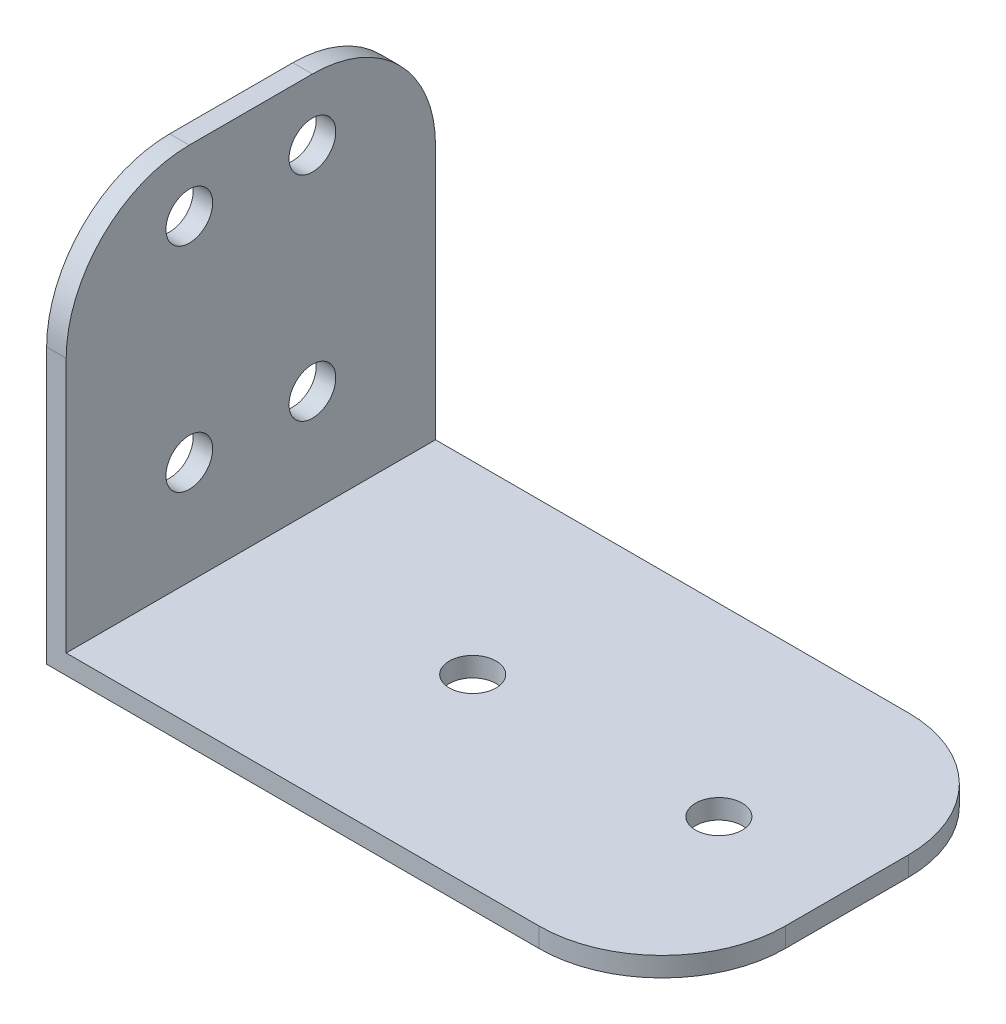
from build123d import *

# Parameters (mm, degrees)
BOSS_EXTRUDE1_DEPTH   = 15
F_6_CLEARANCE_HOLE1_D = 3.7973
FILLET1_R             = 10
F_6_CLEARANCE_HOLE2_D = 3.7973


with BuildPart() as part:
    # Sketch2 → Boss-Extrude1 (new, symmetric)
    with BuildSketch(Plane.XY):
        Polygon((0, 0), (50, 0), (50, 1.5875), (1.5875, 1.5875), (1.5875, 32.32), (0, 32.32), align=None)
    extrude(amount=BOSS_EXTRUDE1_DEPTH, both=True)

    # #6 Clearance Hole1 (through all)
    with Locations(Plane.ZY):
        with Locations((-5, 27.32), (5, 10), (5, 27.32), (-5, 10)):
            Hole(F_6_CLEARANCE_HOLE1_D / 2)

    # Fillet1
    fillet1_edges = [part.edges().sort_by_distance(p)[0] for p in [
        (50, 0.79375, 15),
        (0.79375, 32.32, 15),
        (0.79375, 32.32, -15),
        (50, 0.79375, -15),
    ]]
    fillet(fillet1_edges, radius=FILLET1_R)

    # #6 Clearance Hole2 (through all)
    with Locations(Plane(origin=(0, 0, 0), x_dir=(-1, 0, 0), z_dir=(0, -1, 0))):
        with Locations((-19.61, 0), (-39.61, 0)):
            Hole(F_6_CLEARANCE_HOLE2_D / 2)


solid = part.part
